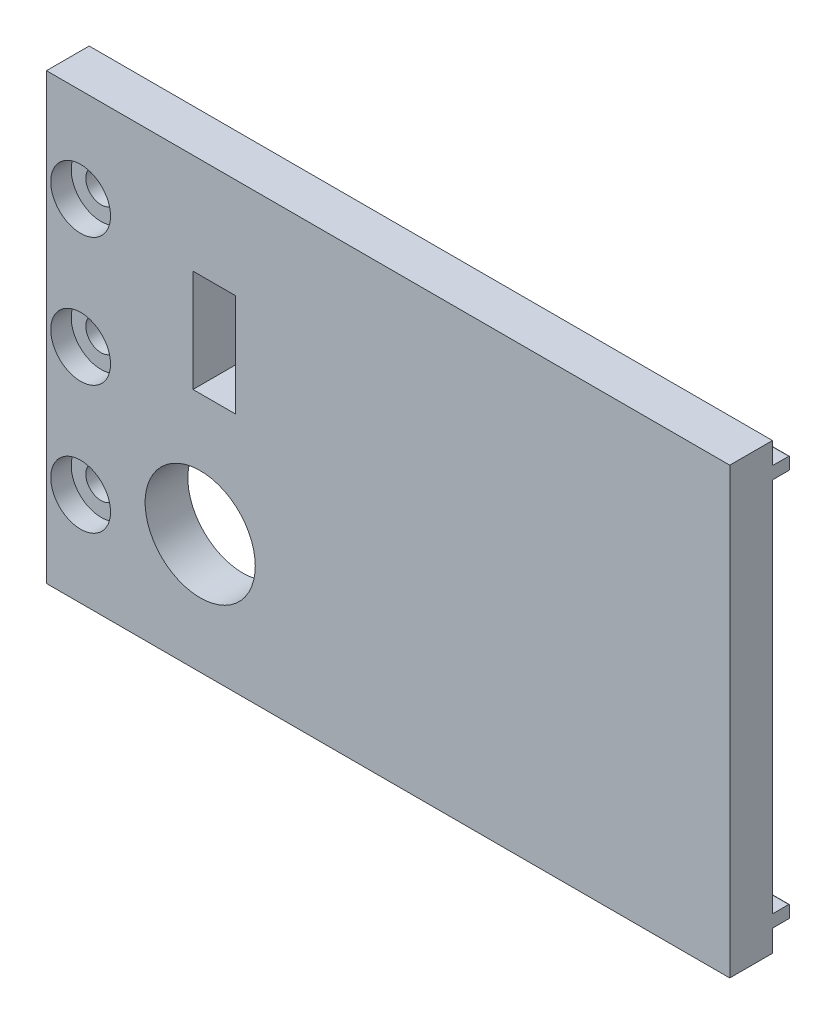
from build123d import *

# Parameters (mm, degrees)
ESQUISSE1_W                                        = 80
ESQUISSE1_H                                        = 52
BOSS_EXTRU_1_DEPTH                                 = 5
ESQUISSE2_R                                        = 6.447859464
ENL_V_MAT_EXTRU_1_DEPTH                            = 5
CHAMBRAGE_POUR_VIS_T_TE_RONDE_BOMB_E_M_D           = 3.6
CHAMBRAGE_POUR_VIS_T_TE_RONDE_BOMB_E_M_CBORE_D     = 7
CHAMBRAGE_POUR_VIS_T_TE_RONDE_BOMB_E_M_CBORE_DEPTH = 2.4
ESQUISSE5_W                                        = 72
ESQUISSE5_H                                        = 1.45
BOSS_EXTRU_2_DEPTH                                 = 2
CONG_1_R                                           = 0.1
ESQUISSE6_W                                        = 5
ESQUISSE6_H                                        = 12
ENL_V_MAT_EXTRU_2_DEPTH                            = 99.420026836


with BuildPart() as part:
    # Esquisse1 → Boss.-Extru.1 (new body)
    with BuildSketch(Plane.XY.offset(16.98011664)):
        with Locations((-44.444303066, 24.066569306)):
            Rectangle(ESQUISSE1_W, ESQUISSE1_H)
    extrude(amount=BOSS_EXTRU_1_DEPTH)

    # Esquisse2 → Enlèv. mat.-Extru.1 (cut)
    with BuildSketch(Plane.XY.offset(21.98011664)):
        with Locations((-66.444303066, 12.061734253)):
            Circle(ESQUISSE2_R)
    extrude(amount=-ENL_V_MAT_EXTRU_1_DEPTH, mode=Mode.SUBTRACT)

    # Chambrage pour vis à tête ronde bombée M34 (through all)
    with Locations(Plane.XY.offset(21.98011664)):
        with Locations((-80.444303066, 9.066569306), (-80.444303066, 24.066569306), (-80.444303066, 39.066569306)):
            CounterBoreHole(CHAMBRAGE_POUR_VIS_T_TE_RONDE_BOMB_E_M_D / 2, CHAMBRAGE_POUR_VIS_T_TE_RONDE_BOMB_E_M_CBORE_D / 2, CHAMBRAGE_POUR_VIS_T_TE_RONDE_BOMB_E_M_CBORE_DEPTH)

    # Esquisse5 → Boss.-Extru.2 (add)
    with BuildSketch(Plane(origin=(0, 0, 16.98011664), x_dir=(-1, 0, 0), z_dir=(0, 0, -1))):
        with Locations((40.444303066, 1.341569306)):
            Rectangle(ESQUISSE5_W, ESQUISSE5_H)
        with Locations((40.444303066, 46.791569306)):
            Rectangle(ESQUISSE5_W, ESQUISSE5_H)
    extrude(amount=BOSS_EXTRU_2_DEPTH)

    # Congé1
    cong_1_edges = [part.edges().sort_by_distance(p)[0] for p in [
        (-40.444303066, 0.616569306, 16.98011664),
        (-40.444303066, 2.066569306, 16.98011664),
        (-40.444303066, 0.616569306, 14.98011664),
        (-40.444303066, 2.066569306, 14.98011664),
        (-40.444303066, 46.066569306, 16.98011664),
        (-40.444303066, 47.516569306, 16.98011664),
        (-40.444303066, 46.066569306, 14.98011664),
        (-40.444303066, 47.516569306, 14.98011664),
    ]]
    fillet(cong_1_edges, radius=CONG_1_R)

    # Esquisse6 → Enlèv. mat.-Extru.2 (cut, through all)
    with BuildSketch(Plane.XY.offset(21.98011664)):
        with Locations((-64.788459284, 32.318430869)):
            Rectangle(ESQUISSE6_W, ESQUISSE6_H)
    extrude(amount=-ENL_V_MAT_EXTRU_2_DEPTH, mode=Mode.SUBTRACT)


solid = part.part
